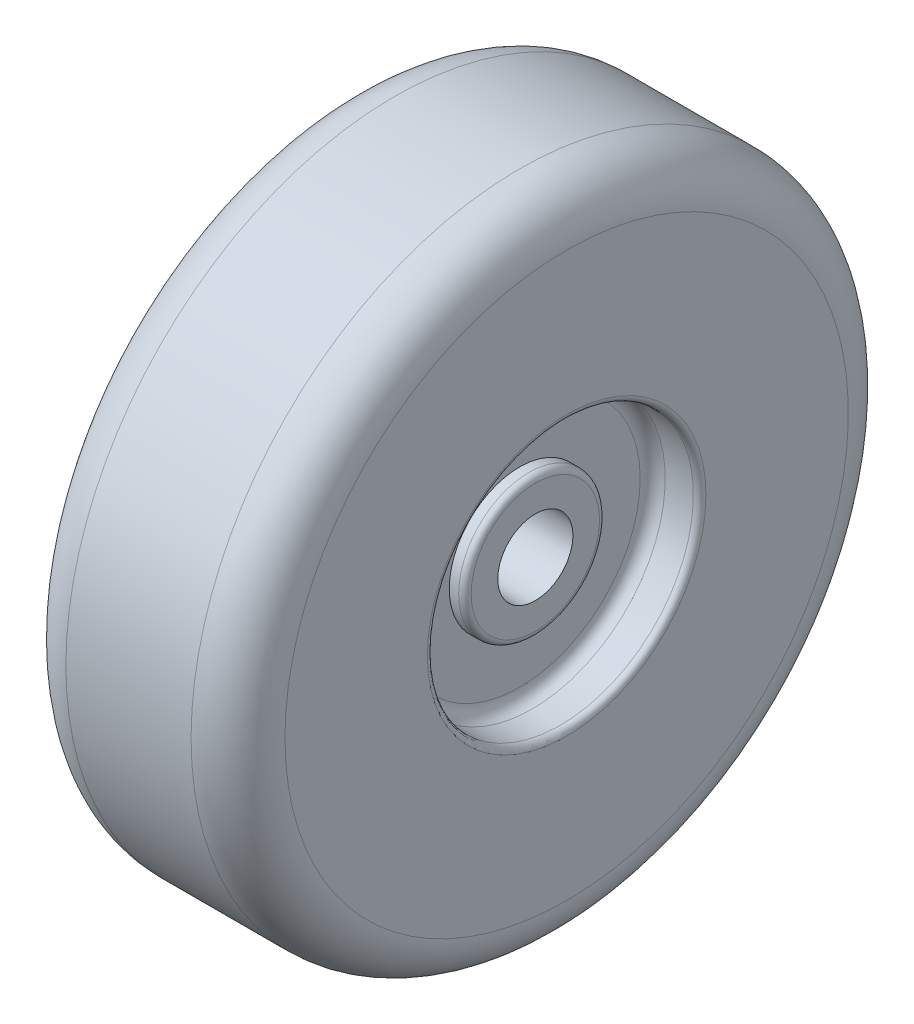
from build123d import *


with BuildPart() as part:
    # Esboço6 → Revolução2 (revolve)
    with BuildSketch(Plane.XY, mode=Mode.PRIVATE) as revolu_o2_sk:
        with BuildLine():
            Line((2.5, 1.2), (2.5, 2.05))
            ThreePointArc((2.5, 2.05), (2.441421356, 2.191421356), (2.3, 2.25))
            Line((2.3, 2.25), (2, 2.25))
            Line((2, 2.25), (2, 3.85))
            ThreePointArc((2, 3.85), (2.117157288, 4.132842712), (2.4, 4.25))
            Line((2.4, 4.25), (3.3, 4.25))
            ThreePointArc((3.3, 4.25), (3.441421356, 4.308578644), (3.5, 4.45))
            Line((3.5, 4.45), (3.5, 9))
            ThreePointArc((3.5, 9), (3.060660172, 10.060660172), (2, 10.5))
            Line((2, 10.5), (-2, 10.5))
            ThreePointArc((-2, 10.5), (-3.060660172, 10.060660172), (-3.5, 9))
            Line((-3.5, 9), (-3.5, 4.45))
            ThreePointArc((-3.5, 4.45), (-3.441421356, 4.308578644), (-3.3, 4.25))
            Line((-3.3, 4.25), (-2.4, 4.25))
            ThreePointArc((-2.4, 4.25), (-2.117157288, 4.132842712), (-2, 3.85))
            Line((-2, 3.85), (-2, 2.25))
            Line((-2, 2.25), (-2.3, 2.25))
            ThreePointArc((-2.3, 2.25), (-2.441421356, 2.191421356), (-2.5, 2.05))
            Line((-2.5, 2.05), (-2.5, 1.2))
            Line((-2.5, 1.2), (2.5, 1.2))
        make_face()
    revolve(revolu_o2_sk.sketch.rotate(Axis((0, 0, 0), (1, 0, 0)), 90), axis=Axis((0, 0, 0), (1, 0, 0)))


solid = part.part
